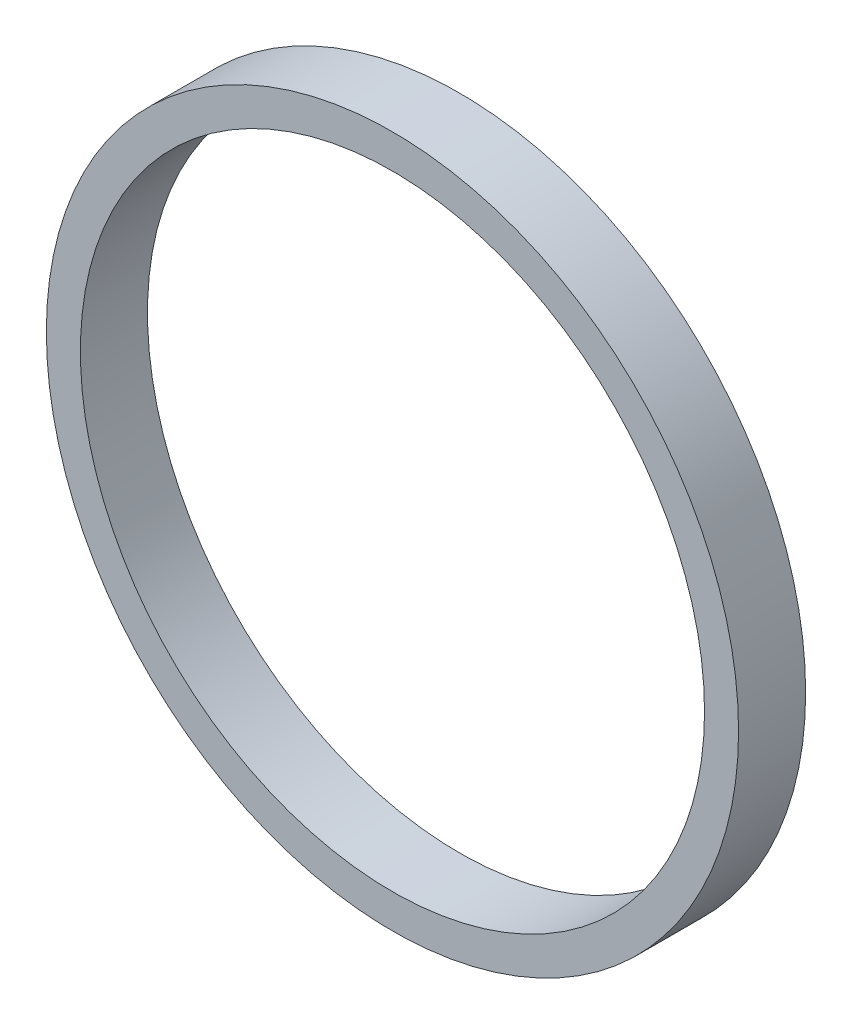
from build123d import *

# Parameters (mm, degrees)
SKETCH1_W = 5.3848
SKETCH1_H = 2.73125


with BuildPart() as part:
    # Sketch1 → Revolve1 (revolve)
    with BuildSketch(Plane(origin=(0, 0, 0), x_dir=(0, 0, -1), z_dir=(1, 0, 0)), mode=Mode.PRIVATE) as revolve1_sk:
        with Locations((0, 26.415625)):
            Rectangle(SKETCH1_W, SKETCH1_H)
    revolve(revolve1_sk.sketch.rotate(Axis((0, 0, 35.62703085), (0, 0, -1)), 90), axis=Axis((0, 0, 35.62703085), (0, 0, -1)))


solid = part.part
